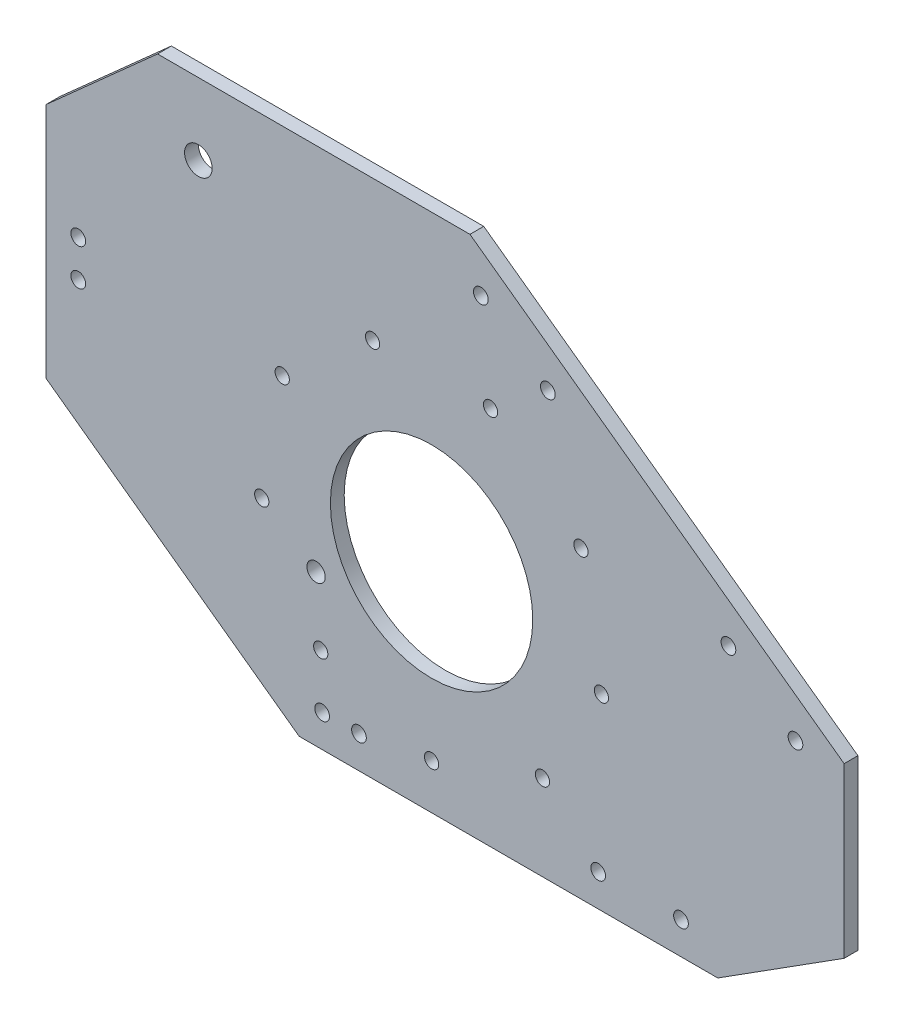
from build123d import *

# Parameters (mm, degrees)
SKETCH_1_R          = 22
SKETCH_1_R_2        = 2
EXTRUDE_1_DEPTH     = 3
SKETCH_2_R          = 3
CUT_EXTRUDE_1_DEPTH = 3
SKETCH_4_R          = 1.550336064
SKETCH_4_R_2        = 1.6
CUT_EXTRUDE_2_DEPTH = 3
SKETCH_5_R          = 1.6
CUT_EXTRUDE_3_DEPTH = 3
SKETCH_6_R          = 1.6
CUT_EXTRUDE_4_DEPTH = 3
SKETCH_7_R          = 1.6
CUT_EXTRUDE_7_DEPTH = 149.01191544


with BuildPart() as part:
    # 草图1 → 凸台-拉伸1 (new body)
    with BuildSketch(Plane(origin=(0, 0, -47.111716595), x_dir=(-1, 0, 0), z_dir=(0, 0, -1))):
        Polygon((-65.204960674, 2.259155248), (25.815510263, 2.259155248), (80.848097232, 42.139739941), (80.848097232, 93.718256609), (56.600680459, 115.359857107), (-11.322058774, 115.359857107), (-92.685654124, 56.364707651), (-92.685654124, 19.698826092), align=None)
        with Locations((-2.976767055, 49.573611164)):
            Circle(SKETCH_1_R, mode=Mode.SUBTRACT)
        with Locations((22.138317691, 35.074213997)):
            Circle(SKETCH_1_R_2, mode=Mode.SUBTRACT)
    extrude(amount=EXTRUDE_1_DEPTH)

    # 草图2 → 切除-拉伸1 (cut)
    with BuildSketch(Plane(origin=(0, 0, -50.111716595), x_dir=(-1, 0, 0), z_dir=(0, 0, -1))):
        with Locations((47.733232945, 99.733611164)):
            Circle(SKETCH_2_R)
    extrude(amount=-CUT_EXTRUDE_1_DEPTH, mode=Mode.SUBTRACT)

    # 草图4 → 切除-拉伸2 (cut)
    with BuildSketch(Plane(origin=(0, 0, -50.111716595), x_dir=(-1, 0, 0), z_dir=(0, 0, -1))):
        with Locations((21.127768308, 20.846944547)):
            Circle(SKETCH_4_R)
        with Locations((-2.976767055, 12.073611164)):
            Circle(SKETCH_4_R)
        with Locations((-27.081302418, 20.846944547)):
            Circle(SKETCH_4_R)
        with Locations((-39.907057793, 43.061804502)):
            Circle(SKETCH_4_R)
        with Locations((-35.452719697, 68.323611164)):
            Circle(SKETCH_4_R)
        with Locations((-15.802522429, 84.812084444)):
            Circle(SKETCH_4_R)
        with Locations((9.84898832, 84.812084444)):
            Circle(SKETCH_4_R)
        with Locations((29.499185587, 68.323611164)):
            Circle(SKETCH_4_R)
        with Locations((33.953694149, 43.062771337)):
            Circle(SKETCH_4_R)
        with Locations((-57.204960674, 9.259155248)):
            Circle(SKETCH_4_R_2)
        with Locations((-39.204960674, 9.259155248)):
            Circle(SKETCH_4_R_2)
    extrude(amount=-CUT_EXTRUDE_2_DEPTH, mode=Mode.SUBTRACT)

    # 草图5 → 切除-拉伸3 (cut)
    with BuildSketch(Plane(origin=(0, 0, -50.111716595), x_dir=(-1, 0, 0), z_dir=(0, 0, -1))):
        with Locations((73.848097232, 72.218256609)):
            Circle(SKETCH_5_R)
        with Locations((73.848097232, 64.218256609)):
            Circle(SKETCH_5_R)
    extrude(amount=-CUT_EXTRUDE_3_DEPTH, mode=Mode.SUBTRACT)

    # 草图6 → 切除-拉伸4 (cut)
    with BuildSketch(Plane(origin=(0, 0, -50.111716595), x_dir=(-1, 0, 0), z_dir=(0, 0, -1))):
        with Locations((-82.099946385, 55.393733062)):
            Circle(SKETCH_6_R)
        with Locations((-67.527515299, 65.959917436)):
            Circle(SKETCH_6_R)
        with Locations((-28.262054197, 94.430534254)):
            Circle(SKETCH_6_R)
        with Locations((-13.689623111, 104.996718629)):
            Circle(SKETCH_6_R)
    extrude(amount=-CUT_EXTRUDE_4_DEPTH, mode=Mode.SUBTRACT)

    # 草图7 → 切除-拉伸7 (cut, through all)
    with BuildSketch(Plane(origin=(0, 0, -50.111716595), x_dir=(-1, 0, 0), z_dir=(0, 0, -1))):
        with Locations((12.815510263, 9.259155248)):
            Circle(SKETCH_7_R)
        with Locations((20.815510263, 9.259155248)):
            Circle(SKETCH_7_R)
    extrude(amount=-CUT_EXTRUDE_7_DEPTH, mode=Mode.SUBTRACT)


solid = part.part
